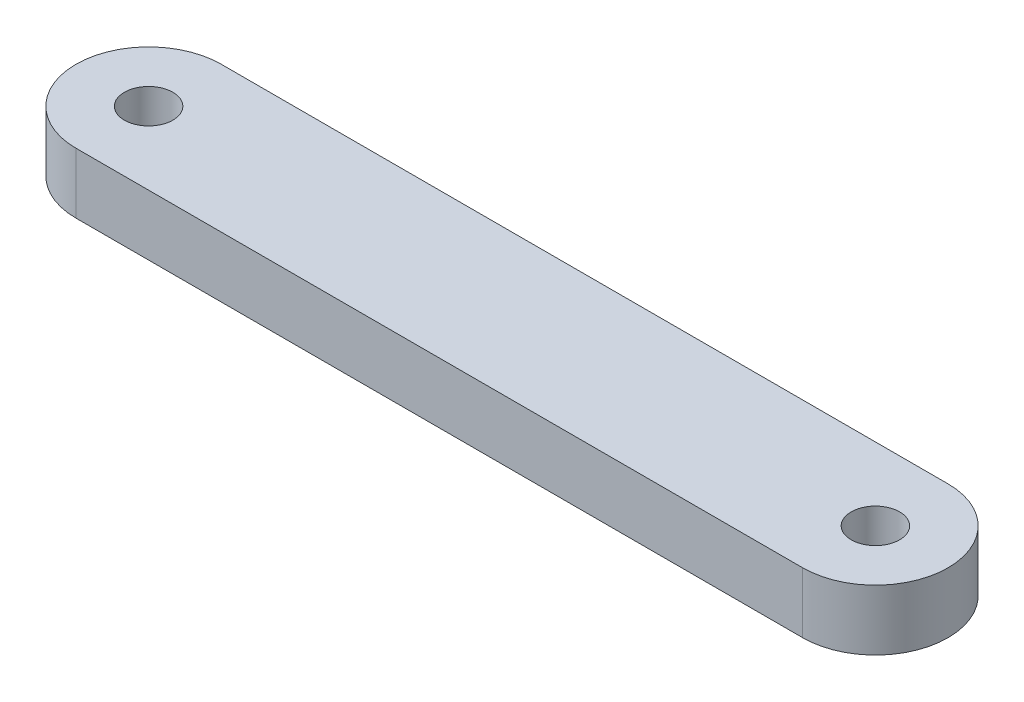
from build123d import *

# Parameters (mm, degrees)
SKETCH_1_R      = 1
EXTRUDE_1_DEPTH = 2.5


with BuildPart() as part:
    # 草图1 → 凸台-拉伸1 (new body)
    with BuildSketch(Plane(origin=(0, 0, 0), x_dir=(1, 0, 0), z_dir=(0, 1, 0))):
        with BuildLine():
            Line((-15, 3), (15, 3))
            ThreePointArc((15, 3), (18, 0), (15, -3))
            Line((15, -3), (-15, -3))
            ThreePointArc((-15, -3), (-18, 0), (-15, 3))
        make_face()
        with Locations(Location((-15, 0, 0), (0, 0, 270))):
            Circle(SKETCH_1_R, mode=Mode.SUBTRACT)
        with Locations(Location((15, 0, 0), (0, 0, 270))):
            Circle(SKETCH_1_R, mode=Mode.SUBTRACT)
    extrude(amount=EXTRUDE_1_DEPTH)


solid = part.part
